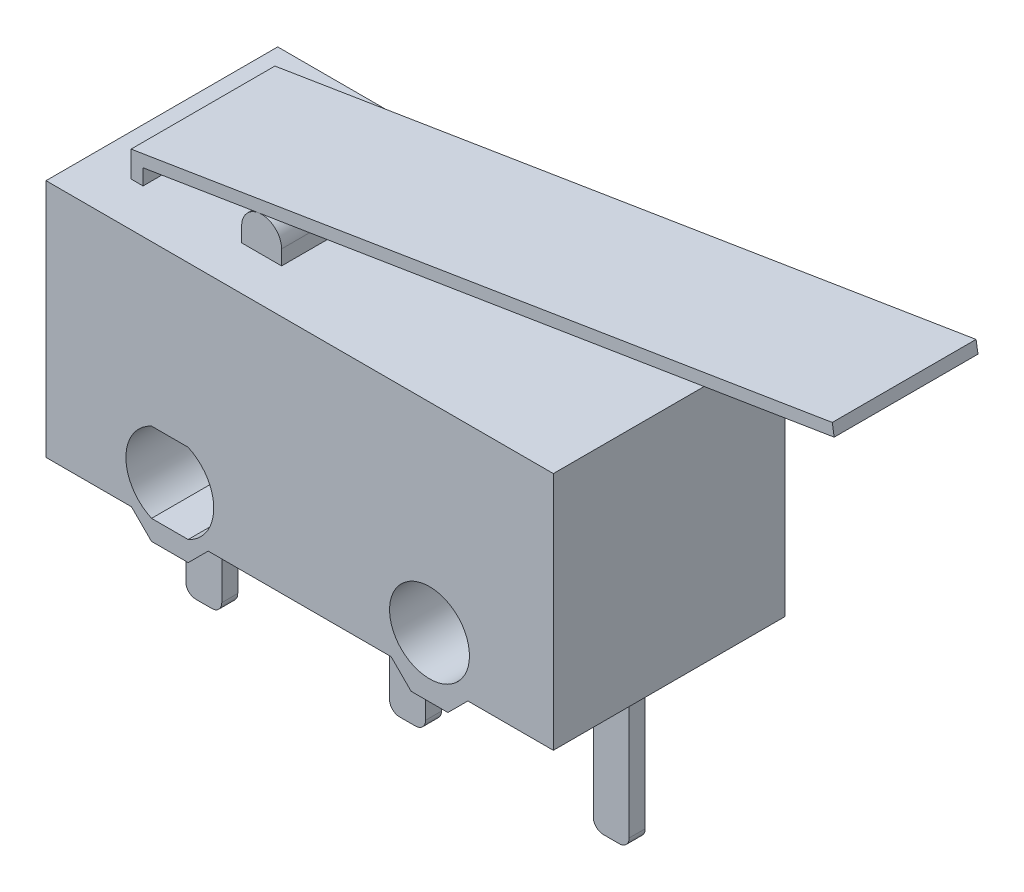
from build123d import *

# Parameters (mm, degrees)
SKETCH8_R              = 1
BOSS_EXTRUDE10_DEPTH   = 2.9
BOSS_EXTRUDE11_DEPTH   = 0.2
BOSS_EXTRUDE13_DEPTH   = 1.8
BOSS_EXTRUDE13_2_DEPTH = 1.8


with BuildPart() as part:
    # Sketch8 → Boss-Extrude10 (new, symmetric)
    with BuildSketch(Plane.XY):
        Polygon((6.260240616, 5.160692651), (-6.439759384, 5.160692651), (-6.439759384, -0.839307349), (-5.639759384, -0.839307349), (-4.739759384, -0.839307349), (-4.300072285, -0.839307349), (-3.800072285, -1.339307349), (-2.879446483, -1.339307349), (-2.379446483, -0.839307349), (-0.539759384, -0.839307349), (0.360240616, -0.839307349), (2.199927715, -0.839307349), (2.699927715, -1.339307349), (3.620553517, -1.339307349), (4.120553517, -0.839307349), (4.560240616, -0.839307349), (5.460240616, -0.839307349), (6.260240616, -0.839307349), align=None)
        with BuildLine():
            ThreePointArc((-3.798016954, -0.839307349), (-4.439759384, 0.160692651), (-3.798016954, 1.160692651))
            Line((-3.798016954, 1.160692651), (-2.881501815, 1.160692651))
            ThreePointArc((-2.881501815, 1.160692651), (-2.239759384, 0.160692651), (-2.881501815, -0.839307349))
            Line((-2.881501815, -0.839307349), (-3.798016954, -0.839307349))
        make_face(mode=Mode.SUBTRACT)
        with Locations((3.160240616, 0.160692651)):
            Circle(SKETCH8_R, mode=Mode.SUBTRACT)
    extrude(amount=BOSS_EXTRUDE10_DEPTH, both=True)

    # Sketch8<3> → Boss-Extrude11 (add, symmetric)
    with BuildSketch(Plane.XY):
        with BuildLine():
            Line((-4.739759384, -0.839307349), (-5.639759384, -0.839307349))
            Line((-5.639759384, -0.839307349), (-5.639759384, -4.489307349))
            ThreePointArc((-5.639759384, -4.489307349), (-5.566536079, -4.666084044), (-5.389759384, -4.739307349))
            Line((-5.389759384, -4.739307349), (-4.989759384, -4.739307349))
            ThreePointArc((-4.989759384, -4.739307349), (-4.812982689, -4.666084044), (-4.739759384, -4.489307349))
            Line((-4.739759384, -4.489307349), (-4.739759384, -0.839307349))
        make_face()
        with BuildLine():
            Line((5.460240616, -4.489307349), (5.460240616, -0.839307349))
            Line((5.460240616, -0.839307349), (4.560240616, -0.839307349))
            Line((4.560240616, -0.839307349), (4.560240616, -4.489307349))
            ThreePointArc((4.560240616, -4.489307349), (4.633463921, -4.666084044), (4.810240616, -4.739307349))
            Line((4.810240616, -4.739307349), (5.210240616, -4.739307349))
            ThreePointArc((5.210240616, -4.739307349), (5.387017311, -4.666084044), (5.460240616, -4.489307349))
        make_face()
        with BuildLine():
            Line((0.360240616, -0.839307349), (-0.539759384, -0.839307349))
            Line((-0.539759384, -0.839307349), (-0.539759384, -4.489307349))
            ThreePointArc((-0.539759384, -4.489307349), (-0.466536079, -4.666084044), (-0.289759384, -4.739307349))
            Line((-0.289759384, -4.739307349), (0.110240616, -4.739307349))
            ThreePointArc((0.110240616, -4.739307349), (0.287017311, -4.666084044), (0.360240616, -4.489307349))
            Line((0.360240616, -4.489307349), (0.360240616, -0.839307349))
        make_face()
    extrude(amount=BOSS_EXTRUDE11_DEPTH, both=True)


with BuildPart() as body_2:
    # Sketch9 → Boss-Extrude13 (new, symmetric)
    with BuildSketch(Plane.XY):
        with BuildLine():
            ThreePointArc((-1.641889185, 5.530415203), (-1.817910279, 5.911253317), (-2.22203986, 6.023949264))
            ThreePointArc((-2.22203986, 6.023949264), (-2.522727298, 5.854394108), (-2.641889185, 5.530415203))
            Line((-2.641889185, 5.530415203), (-2.641889185, 5.160692651))
            Line((-2.641889185, 5.160692651), (-1.641889185, 5.160692651))
            Line((-1.641889185, 5.160692651), (-1.641889185, 5.530415203))
        make_face()
    extrude(amount=BOSS_EXTRUDE13_DEPTH, both=True)


with BuildPart() as body_3:
    # Sketch9 → Boss-Extrude13 2 (new, symmetric)
    with BuildSketch(Plane.XY):
        Polygon((-5.409987829, 5.810151849), (-5.409987829, 5.160692651), (-5.109987829, 5.160692651), (-5.109987829, 5.55494193), (-2.22203986, 6.023949264), (12.19052222, 8.364572219), (12.142431792, 8.660692651), align=None)
    extrude(amount=BOSS_EXTRUDE13_2_DEPTH, both=True)


solid = Compound([part.part, body_2.part, body_3.part])
